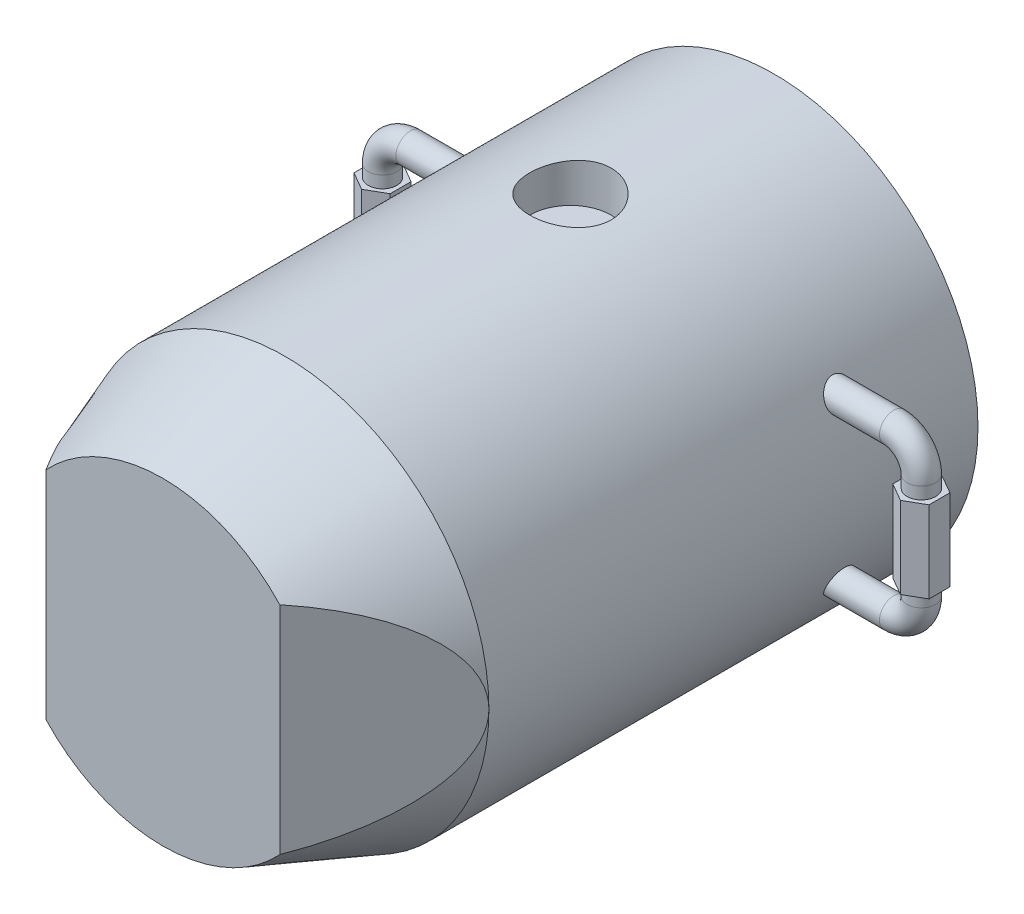
from build123d import *

# Parameters (mm, degrees)
IZIM1_R                     = 50
Y_KSEKLIK_EKSTR_ZYON1_DEPTH = 150
PAH1_SIZE                   = 30
PAH1_SIZE2                  = 10.919107028
KES_EKSTR_ZYON1_DEPTH       = 50
S_P_R1_PROFILE_R            = 3.5
KES_EKSTR_ZYON2_START       = -40
IZIM20_R                    = 10
KES_EKSTR_ZYON2_DEPTH       = 100
Y_KSEKLIK_EKSTR_ZYON2_DEPTH = 10


with BuildPart() as part:
    # Çizim1 → Yükseklik-Ekstrüzyon1 (new body)
    with BuildSketch(Plane.XY):
        Circle(IZIM1_R)
    extrude(amount=Y_KSEKLIK_EKSTR_ZYON1_DEPTH)

    # Pah1
    pah1_edges = [part.edges().sort_by_distance(p)[0] for p in [
        (-50, 0, 150),
    ]]
    pah1_side = [part.faces().sort_by_distance(p)[0] for p in [
        (-50, 0, 75),
    ]]
    chamfer(pah1_edges, length=PAH1_SIZE, length2=PAH1_SIZE2, reference=pah1_side[0])

    # Çizim5 → Kes-Ekstrüzyon1 (cut, symmetric)
    with BuildSketch(Plane(origin=(0, 0, 0), x_dir=(1, 0, 0), z_dir=(0, 1, 0))):
        Polygon((-50, -120), (-120.002601454, -158.048405528), (-22.959282712, -158.048405528), align=None)
        Polygon((22.959282712, -158.048405528), (50, -120), (120.002601454, -158.048405528), align=None)
    extrude(amount=KES_EKSTR_ZYON1_DEPTH, both=True, mode=Mode.SUBTRACT)

    # Süpür1: sweep along a path in Çizim6
    with BuildLine(Plane.XY.offset(30)) as s_p_r1_path:
        Line((-44.301038276, -19.710381189), (-59.325338364, -19.710381189))
        ThreePointArc((-59.325338364, -19.710381189), (-64.118952606, -17.724801158), (-66.104532637, -12.931186916))
        Line((-66.104532637, -12.931186916), (-66.104532637, 12.931186916))
        ThreePointArc((-66.104532637, 12.931186916), (-64.118952606, 17.724801158), (-59.325338364, 19.710381189))
        Line((-59.325338364, 19.710381189), (-44.301038276, 19.710381189))
    # Süpür1 profile (on start of the path) → Süpür1 (sweep)
    with BuildSketch(Plane(origin=(-44.301038276, -19.710381189, 30), x_dir=(0, 0, -1), z_dir=(-1, 0, 0))):
        Circle(S_P_R1_PROFILE_R)
    s_p_r1 = sweep(path=s_p_r1_path.line)

    # Aynalama1: Süpür1 across plane
    add(s_p_r1.mirror(Plane(origin=(0, 0, 0), x_dir=(0, 0, 1), z_dir=(1, 0, 0))))

    # Çizim20 → Kes-Ekstrüzyon2 (cut)
    with BuildSketch(Plane(origin=(0, 0, 0), x_dir=(1, 0, 0), z_dir=(0, 1, 0)).offset(KES_EKSTR_ZYON2_START)):
        with Locations(Location((0, -50, 0), (0, 0, 270))):
            Circle(IZIM20_R)
    kes_ekstr_zyon2 = extrude(amount=-KES_EKSTR_ZYON2_DEPTH, mode=Mode.SUBTRACT)

    # Aynalama2: Kes-Ekstrüzyon2 across plane
    add(kes_ekstr_zyon2.mirror(Plane.ZX), mode=Mode.SUBTRACT)

    # Çizim21 → Yükseklik-Ekstrüzyon2 (add, symmetric)
    with BuildSketch(Plane(origin=(0, 0, 0), x_dir=(1, 0, 0), z_dir=(0, 1, 0))):
        Polygon((-66.104532637, -35.126982438), (-61.664435601, -32.563491219), (-61.664435601, -27.436508781), (-66.104532637, -24.873017562), (-70.544629673, -27.436508781), (-70.544629673, -32.563491219), align=None)
    y_kseklik_ekstr_zyon2 = extrude(amount=Y_KSEKLIK_EKSTR_ZYON2_DEPTH, both=True)

    # Aynalama3: Yükseklik-Ekstrüzyon2 across plane
    add(y_kseklik_ekstr_zyon2.mirror(Plane(origin=(0, 0, 0), x_dir=(0, 0, 1), z_dir=(1, 0, 0))))


solid = part.part
